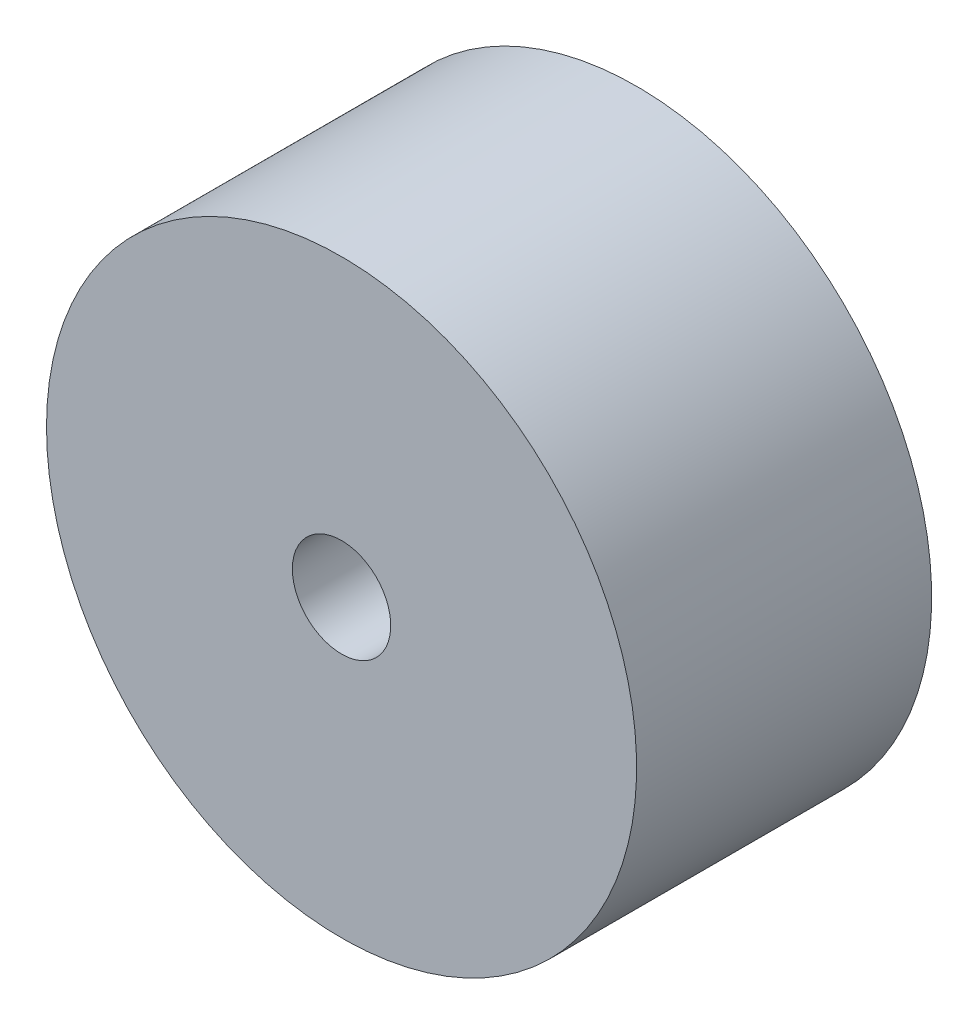
from build123d import *

# Parameters (mm, degrees)
ESQUISSE1_R        = 38.1
ESQUISSE1_R_2      = 6.35
BOSS_EXTRU_1_DEPTH = 38.1


with BuildPart() as part:
    # Esquisse1 → Boss.-Extru.1 (new body)
    with BuildSketch(Plane.XY):
        with Locations(Location((0, 0, 0), (0, 0, 180))):
            Circle(ESQUISSE1_R)
        with Locations(Location((0, 0, 0), (0, 0, 180))):
            Circle(ESQUISSE1_R_2, mode=Mode.SUBTRACT)
    extrude(amount=BOSS_EXTRU_1_DEPTH)


solid = part.part
